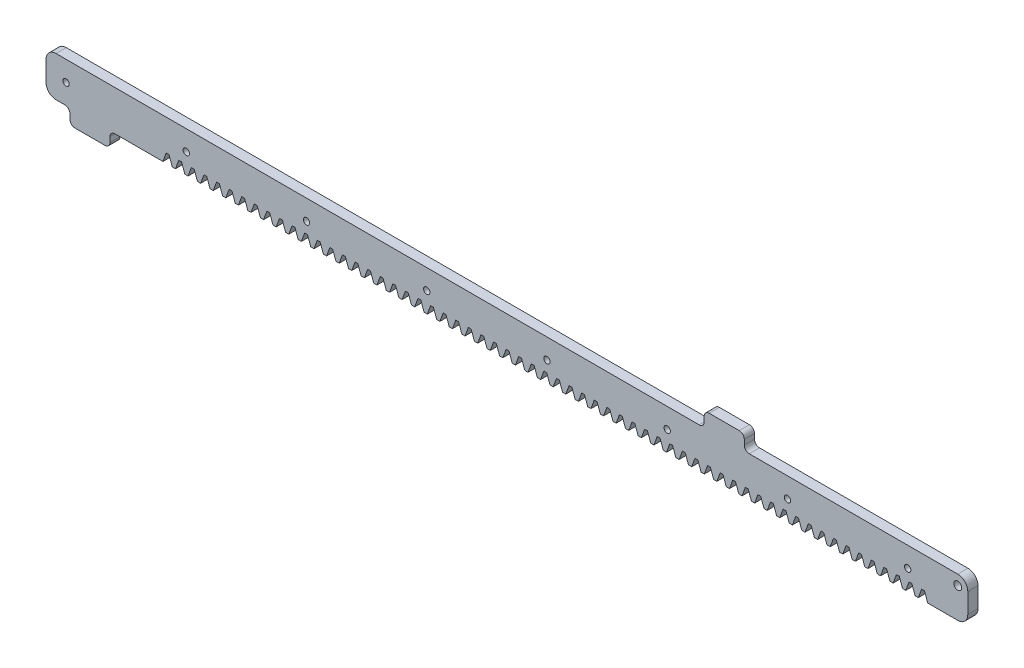
from build123d import *

# Parameters (mm, degrees)
SKETCH1_R           = 2.4892
BOSS_EXTRUDE1_DEPTH = 6.477
FILLET2_R           = 6.35
CUT_EXTRUDE1_DEPTH  = 586.278862726
LPATTERN1_COUNT     = 61
LPATTERN1_PITCH     = 7.979645331
SKETCH3_R           = 2.0193
CUT_EXTRUDE2_DEPTH  = 586.278862726
LPATTERN2_COUNT     = 8
LPATTERN2_PITCH     = 76.2
FILLET3_R           = 3.175


with BuildPart() as part:
    # Sketch1 → Boss-Extrude1 (new body)
    with BuildSketch(Plane.XY):
        Polygon((0, 0), (15.13078, 0), (15.13078, -9.525), (40.53078, -9.525), (40.53078, 0), (584.2, 0), (584.2, 25.4), (533.4, 25.4), (442.540898, 25.4), (442.540898, 34.925), (417.140898, 34.925), (417.140898, 25.4), (40.53078, 25.4), (0, 25.4), align=None)
        with Locations((577.85, 19.05)):
            Circle(SKETCH1_R, mode=Mode.SUBTRACT)
    extrude(amount=BOSS_EXTRUDE1_DEPTH)

    # Fillet2
    fillet2_edges = [part.edges().sort_by_distance(p)[0] for p in [
        (584.2, 25.4, 3.2385),
        (584.2, 0, 3.2385),
        (0, 0, 3.2385),
        (0, 25.4, 3.2385),
    ]]
    fillet(fillet2_edges, radius=FILLET2_R)

    # Sketch2 → Cut-Extrude1 (cut, through all)
    with BuildSketch(Plane.XY.offset(6.477)):
        Polygon((552.86876001, 0), (558.8, 0), (556.719910111, 5.715), (554.948849899, 5.715), align=None)
    cut_extrude1 = extrude(amount=-CUT_EXTRUDE1_DEPTH, mode=Mode.SUBTRACT)

    # LPattern1: Cut-Extrude1 ×61
    with Locations(*[(-i * LPATTERN1_PITCH, 0, 0) for i in range(1, LPATTERN1_COUNT)]):
        add(cut_extrude1, mode=Mode.SUBTRACT)

    # Sketch3 → Cut-Extrude2 (cut, through all)
    with BuildSketch(Plane.XY.offset(6.477)):
        with Locations((546.1, 12.7)):
            Circle(SKETCH3_R)
    cut_extrude2 = extrude(amount=-CUT_EXTRUDE2_DEPTH, mode=Mode.SUBTRACT)

    # LPattern2: Cut-Extrude2 ×8
    with Locations(*[(-i * LPATTERN2_PITCH, 0, 0) for i in range(1, LPATTERN2_COUNT)]):
        add(cut_extrude2, mode=Mode.SUBTRACT)

    # Fillet3
    fillet3_edges = [part.edges().sort_by_distance(p)[0] for p in [
        (442.540898, 25.4, 3.2385),
        (40.53078, 0, 3.2385),
        (40.53078, -9.525, 3.2385),
        (15.13078, -9.525, 3.2385),
        (15.13078, 0, 3.2385),
        (417.140898, 25.4, 3.2385),
        (417.140898, 34.925, 3.2385),
        (442.540898, 34.925, 3.2385),
    ]]
    fillet(fillet3_edges, radius=FILLET3_R)


solid = part.part
